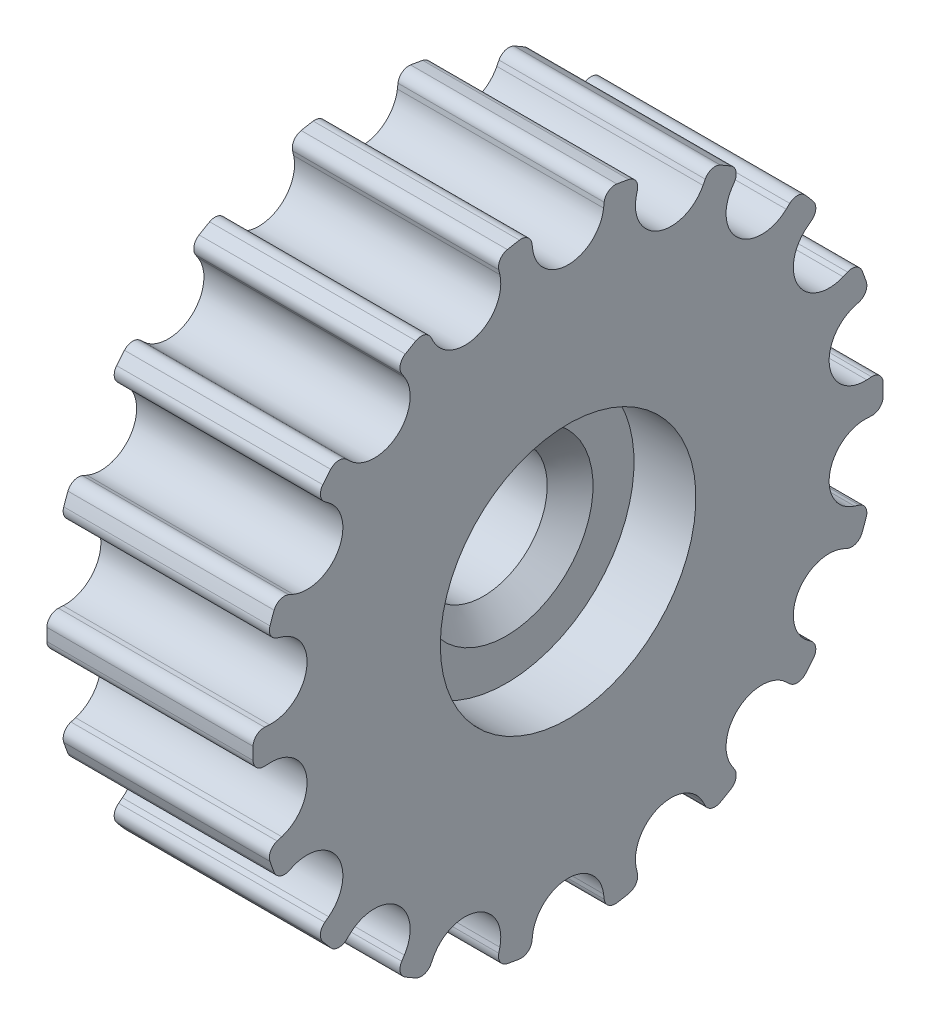
from build123d import *

# Parameters (mm, degrees)
CHAMFER_1_SIZE           = 1
SKETCH_4_W               = 2
SKETCH_4_H               = 1.185454952
CUT_EXTRUDE_1_DEPTH      = 22.431052657
CUT_EXTRUDE_2_REACH      = 23.431
PATTERN_CIRCULAR_3_COUNT = 18


with BuildPart() as part:
    # 草图1 → 旋转1 (revolve)
    with BuildSketch(Plane.XY):
        Polygon((0, 2.7888), (0, 13.753), (9, 13.753), (9, 5.5776), (6.3, 5.5776), (6.3, 2.7888), align=None)
    revolve(axis=Axis((0, 0, 0), (1, 0, 0)))

    # 倒角1
    chamfer_1_edges = [part.edges().sort_by_distance(p)[0] for p in [
        (6.3, -2.7888, 0),
        (0, -2.7888, 0),
    ]]
    chamfer(chamfer_1_edges, length=CHAMFER_1_SIZE)

    # 草图4 → 切除-拉伸1 (cut, through all)
    with BuildSketch(Plane.ZY):
        with Locations((0, 3.196072524)):
            Rectangle(SKETCH_4_W, SKETCH_4_H)
    extrude(amount=-CUT_EXTRUDE_1_DEPTH, mode=Mode.SUBTRACT)

    # 草图6 → 切除-拉伸2 (cut, up to next)
    with BuildSketch(Plane(origin=(0, 0, 0), x_dir=(0, 0, -1), z_dir=(1, 0, 0)), mode=Mode.PRIVATE) as cut_extrude_2_sk1:
        with BuildLine():
            Line((1.574067282, 13.17215513), (1.548371997, 12.962883824))
            ThreePointArc((1.548371997, 12.962883824), (0, 11.593), (-1.548371997, 12.962883824))
            Line((-1.548371997, 12.962883824), (-1.574067282, 13.17215513))
            ThreePointArc((-1.574067282, 13.17215513), (-1.761240253, 13.496717776), (-2.124642597, 13.587895453))
            ThreePointArc((-2.124642597, 13.587895453), (-2.36143787, 13.548749765), (-2.597513963, 13.505477785))
            Line((-2.597513963, 13.505477785), (-2.794161951, 15.107047128))
            ThreePointArc((-2.794161951, 15.107047128), (0, 15.363274844), (2.794161951, 15.107047128))
            Line((2.794161951, 15.107047128), (2.597513963, 13.505477785))
            ThreePointArc((2.597513963, 13.505477785), (2.36143787, 13.548749765), (2.124642597, 13.587895453))
            ThreePointArc((2.124642597, 13.587895453), (1.761240253, 13.496717776), (1.574067282, 13.17215513))
        make_face()
    cut_extrude_2_tool1 = extrude(cut_extrude_2_sk1.sketch, amount=CUT_EXTRUDE_2_REACH, mode=Mode.PRIVATE) & part.part
    cut_extrude_2 = cut_extrude_2_tool1.solids().sort_by_distance((0, 13.819423, 0))[0]
    add(cut_extrude_2, mode=Mode.SUBTRACT)

    # 阵列(圆周)3: 切除-拉伸2 ×18 about axis
    pattern_circular_3_axis = Axis((-1.4, 0, 0), (1, 0, 0))
    for i in range(1, PATTERN_CIRCULAR_3_COUNT):
        add(cut_extrude_2.rotate(pattern_circular_3_axis, i * 360 / PATTERN_CIRCULAR_3_COUNT), mode=Mode.SUBTRACT)


solid = part.part
